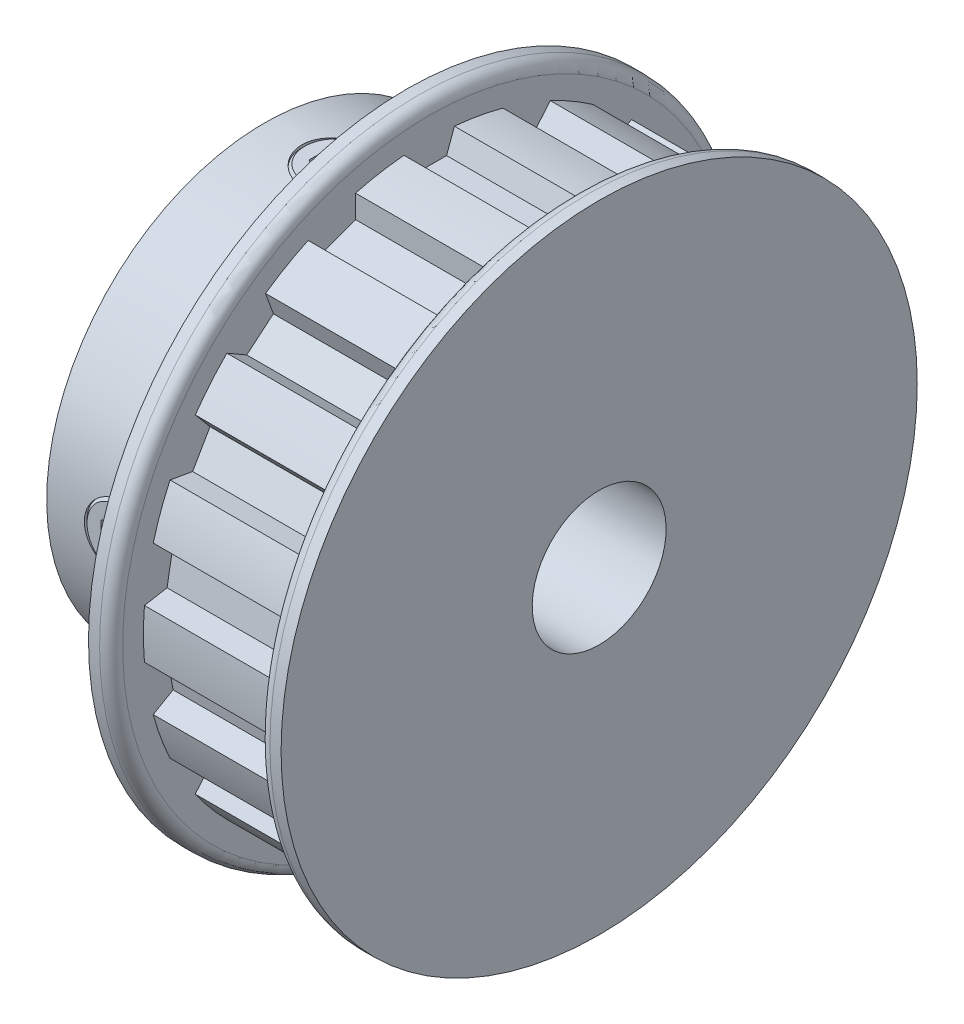
from build123d import *

# Parameters (mm, degrees)
SKETCH4_R          = 27.2923
SKETCH4_R_2        = 27.1012539
CUT_EXTRUDE2_DEPTH = 13.97
CUT_EXTRUDE1_DEPTH = 13.97
CIRPATTERN1_COUNT  = 18
SKETCH6_R          = 3.175
CUT_EXTRUDE3_DEPTH = 46.514486018
CUT_EXTRUDE4_DEPTH = 2.032
CIRPATTERN2_COUNT  = 2
CIRPATTERN2_ANGLE  = 90
CIRPATTERN3_COUNT  = 2
CIRPATTERN3_ANGLE  = 90


with BuildPart() as part:
    # Sketch1 → Revolve1 (revolve)
    with BuildSketch(Plane.XY, mode=Mode.PRIVATE) as revolve1_sk:
        with BuildLine():
            Line((-15.875, 6.35), (15.875, 6.35))
            Line((15.875, 6.35), (15.875, 30.1625))
            Line((15.875, 30.1625), (14.8209, 30.1625))
            ThreePointArc((14.8209, 30.1625), (14.048597974, 29.842602026), (13.7287, 29.0703))
            Line((13.7287, 29.0703), (13.7287, 27.2923))
            Line((13.7287, 27.2923), (-0.2413, 27.2923))
            Line((-0.2413, 27.2923), (-0.2413, 29.0703))
            ThreePointArc((-0.2413, 29.0703), (-0.561197974, 29.842602026), (-1.3335, 30.1625))
            Line((-1.3335, 30.1625), (-2.3876, 30.1625))
            Line((-2.3876, 30.1625), (-2.3876, 20.6375))
            Line((-2.3876, 20.6375), (-15.875, 20.6375))
            Line((-15.875, 20.6375), (-15.875, 6.35))
        make_face()
    revolve(revolve1_sk.sketch.rotate(Axis((-15.875, 0, 0), (1, 0, 0)), 180), axis=Axis((-15.875, 0, 0), (1, 0, 0)))

    # Sketch4 → Cut-Extrude2 (cut)
    with BuildSketch(Plane(origin=(-0.2413, 0, 0), x_dir=(0, 0, -1), z_dir=(1, 0, 0))):
        Circle(SKETCH4_R)
        with Locations(Location((0, 0, 0), (0, 0, 90))):
            Circle(SKETCH4_R_2, mode=Mode.SUBTRACT)
    extrude(amount=CUT_EXTRUDE2_DEPTH, mode=Mode.SUBTRACT)

    # Sketch3 → Cut-Extrude1 (cut)
    with BuildSketch(Plane(origin=(-0.2413, 0, 0), x_dir=(0, 0, -1), z_dir=(1, 0, 0))):
        with BuildLine():
            Line((-2.391743806, 26.99550934), (-1.647556394, 24.950871228))
            Line((-1.647556394, 24.950871228), (1.647556394, 24.950871228))
            Line((1.647556394, 24.950871228), (2.391743806, 26.99550934))
            ThreePointArc((2.391743806, 26.99550934), (0, 27.1012539), (-2.391743806, 26.99550934))
        make_face()
    cut_extrude1 = extrude(amount=CUT_EXTRUDE1_DEPTH, mode=Mode.SUBTRACT)

    # CirPattern1: Cut-Extrude1 ×18 about axis
    cirpattern1_axis = Axis((0, 0, 0), (1, 0, 0))
    for i in range(1, CIRPATTERN1_COUNT):
        add(cut_extrude1.rotate(cirpattern1_axis, i * 360 / CIRPATTERN1_COUNT), mode=Mode.SUBTRACT)

    # Sketch6 → Cut-Extrude3 (cut, through all)
    with BuildSketch(Plane(origin=(0, 0, 0), x_dir=(1, 0, 0), z_dir=(0, 1, 0))):
        with Locations(Location((-9.1313, 0, 0), (0, 0, 90))):
            Circle(SKETCH6_R)
    cut_extrude3 = extrude(amount=CUT_EXTRUDE3_DEPTH, mode=Mode.SUBTRACT)

    # CirPattern2: Cut-Extrude3 ×2 about axis
    cirpattern2_axis = Axis((-15.875, 0, 0), (1, 0, 0))
    for i in range(1, CIRPATTERN2_COUNT):
        add(cut_extrude3.rotate(cirpattern2_axis, i * CIRPATTERN2_ANGLE / (CIRPATTERN2_COUNT - 1)), mode=Mode.SUBTRACT)


with BuildPart() as body_2:
    # Sketch7 → Revolve2 (revolve)
    with BuildSketch(Plane.XY, mode=Mode.PRIVATE) as revolve2_sk:
        Polygon((-12.0523, 20.6375), (-9.1313, 20.6375), (-9.1313, 6.731), (-12.0523, 6.731), (-12.3063, 6.985), (-12.3063, 20.3835), align=None)
    revolve(revolve2_sk.sketch.rotate(Axis((-9.1313, 6.731, 0), (0, 1, 0)), 180), axis=Axis((-9.1313, 6.731, 0), (0, 1, 0)))

    # Sketch8 → Cut-Extrude4 (cut)
    with BuildSketch(Plane(origin=(0, 20.6375, 0), x_dir=(1, 0, 0), z_dir=(0, 1, 0))):
        Polygon((-9.1313, 1.833087105), (-10.7188, 0.916543552), (-10.7188, -0.916543552), (-9.1313, -1.833087105), (-7.5438, -0.916543552), (-7.5438, 0.916543552), align=None)
    extrude(amount=-CUT_EXTRUDE4_DEPTH, mode=Mode.SUBTRACT)


with BuildPart() as cirpattern3_1:
    # CirPattern3: pattern copy
    add(body_2.part.rotate(Axis((0, 0, 0), (1, 0, 0)), 1 * CIRPATTERN3_ANGLE / (CIRPATTERN3_COUNT - 1)))


solid = Compound([part.part, body_2.part, cirpattern3_1.part])
